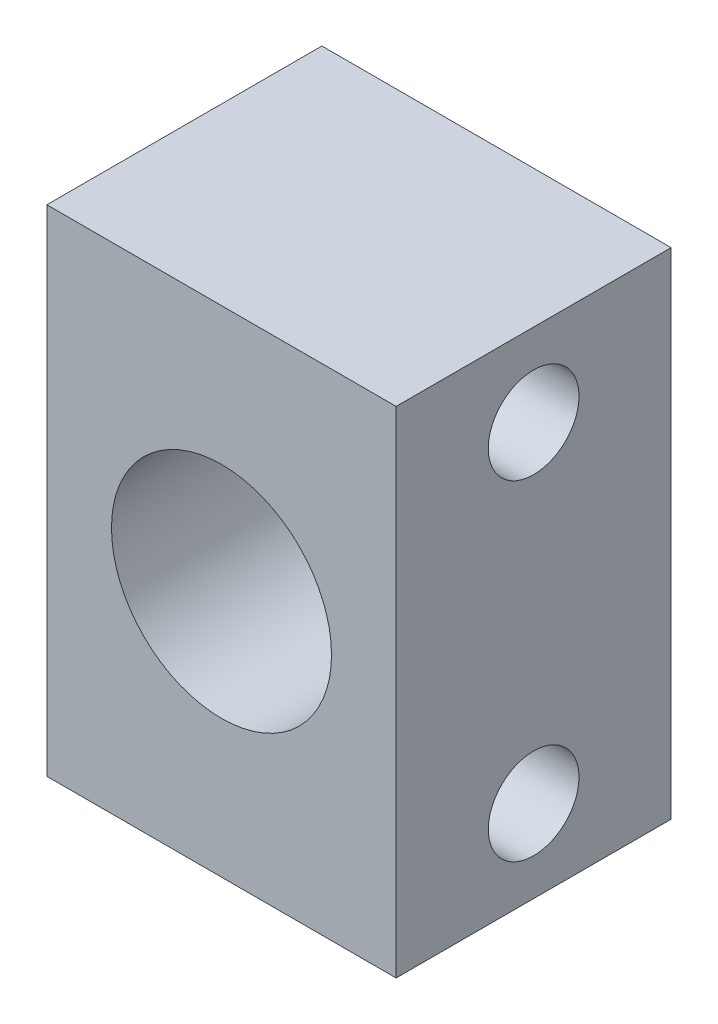
from build123d import *

# Parameters (mm, degrees)
CROQUIS1_W                    = 10
CROQUIS1_H                    = 18
SALIENTE_EXTRUIR1_DEPTH       = 6.35
TALADRO_ROSCADO_M4X0_71_D     = 3.3
DI_METRO_DE_TALADRO_5_0_5_1_D = 8


with BuildPart() as part:
    # Croquis1 → Saliente-Extruir1 (new, symmetric)
    with BuildSketch(Plane(origin=(0, 0, 0), x_dir=(0, 0, -1), z_dir=(1, 0, 0))):
        Rectangle(CROQUIS1_W, CROQUIS1_H)
    extrude(amount=SALIENTE_EXTRUIR1_DEPTH, both=True)

    # Taladro roscado M4x0.71 (through all)
    with Locations(Plane(origin=(6.35, 0, 0), x_dir=(0, 0, -1), z_dir=(1, 0, 0))):
        with Locations((0, 6), (0, -6)):
            Hole(TALADRO_ROSCADO_M4X0_71_D / 2)

    # Diámetro de taladro Ø5.0 (5)1 (through all)
    with Locations(Plane.XY.offset(5)):
        with Locations((0, 0)):
            Hole(DI_METRO_DE_TALADRO_5_0_5_1_D / 2)


solid = part.part
